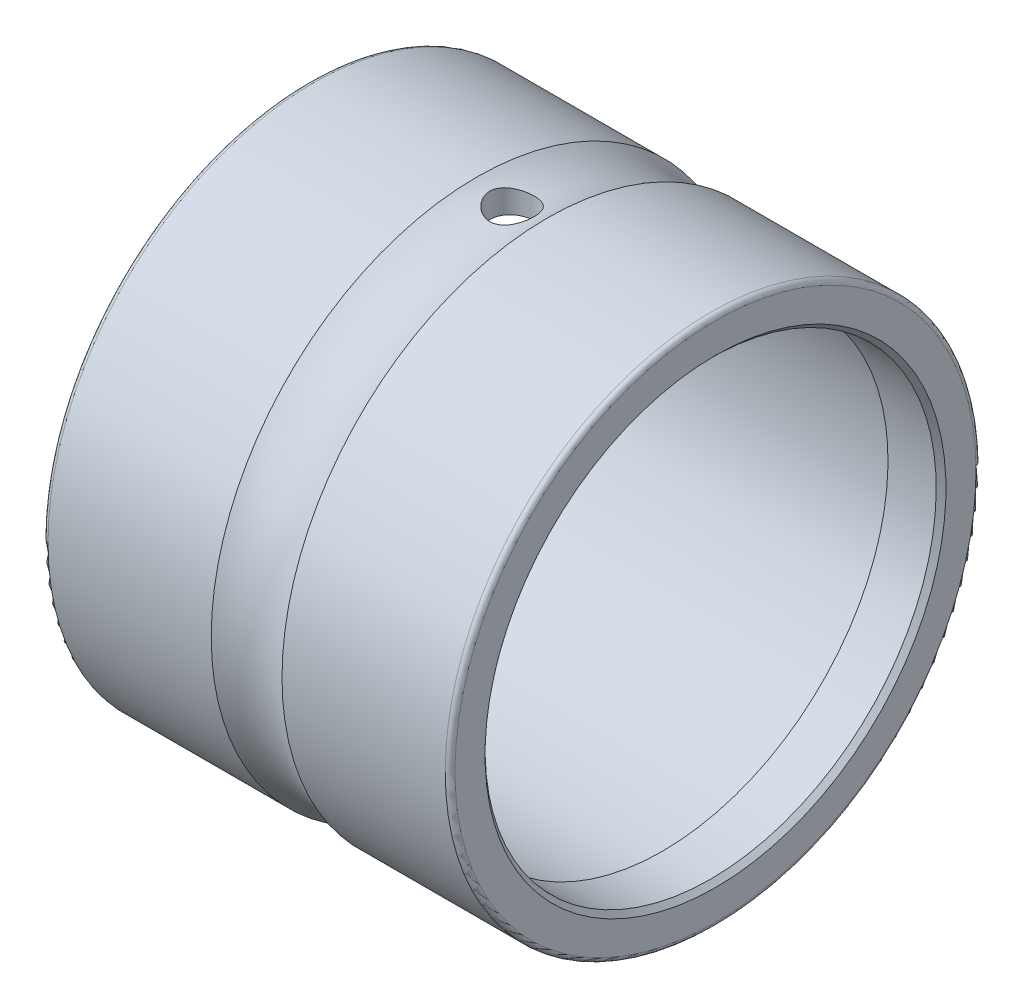
from build123d import *

# Parameters (mm, degrees)
SKETCH4_R          = 1.25
CUT_EXTRUDE1_DEPTH = 25.129857072


with BuildPart() as part:
    # Sketch2 → Revolve1 (revolve)
    with BuildSketch(Plane.XY, mode=Mode.PRIVATE) as revolve1_sk:
        with BuildLine():
            Line((-8.5, 13.3), (8.5, 13.3))
            Line((8.5, 13.3), (8.5, 12.75))
            Line((8.5, 12.75), (11.225, 12.75))
            Line((11.225, 12.75), (11.5, 13.025))
            Line((11.5, 13.025), (11.5, 14.725))
            ThreePointArc((11.5, 14.725), (11.419454365, 14.919454365), (11.225, 15))
            Line((11.225, 15), (2, 15))
            ThreePointArc((2, 15), (0, 14.5), (-2, 15))
            Line((-2, 15), (-11.225, 15))
            ThreePointArc((-11.225, 15), (-11.419454365, 14.919454365), (-11.5, 14.725))
            Line((-11.5, 14.725), (-11.5, 13.025))
            Line((-11.5, 13.025), (-11.225, 12.75))
            Line((-11.225, 12.75), (-8.5, 12.75))
            Line((-8.5, 12.75), (-8.5, 13.3))
        make_face()
    revolve(revolve1_sk.sketch.rotate(Axis((-11.5, 0, 0), (1, 0, 0)), 180), axis=Axis((-11.5, 0, 0), (1, 0, 0)))

    # Sketch4 → Cut-Extrude1 (cut, through all)
    with BuildSketch(Plane(origin=(0, 0, 0), x_dir=(1, 0, 0), z_dir=(0, 1, 0))):
        with Locations(Location((0, 0, 0), (0, 0, 90))):
            Circle(SKETCH4_R)
    extrude(amount=CUT_EXTRUDE1_DEPTH, mode=Mode.SUBTRACT)


solid = part.part
